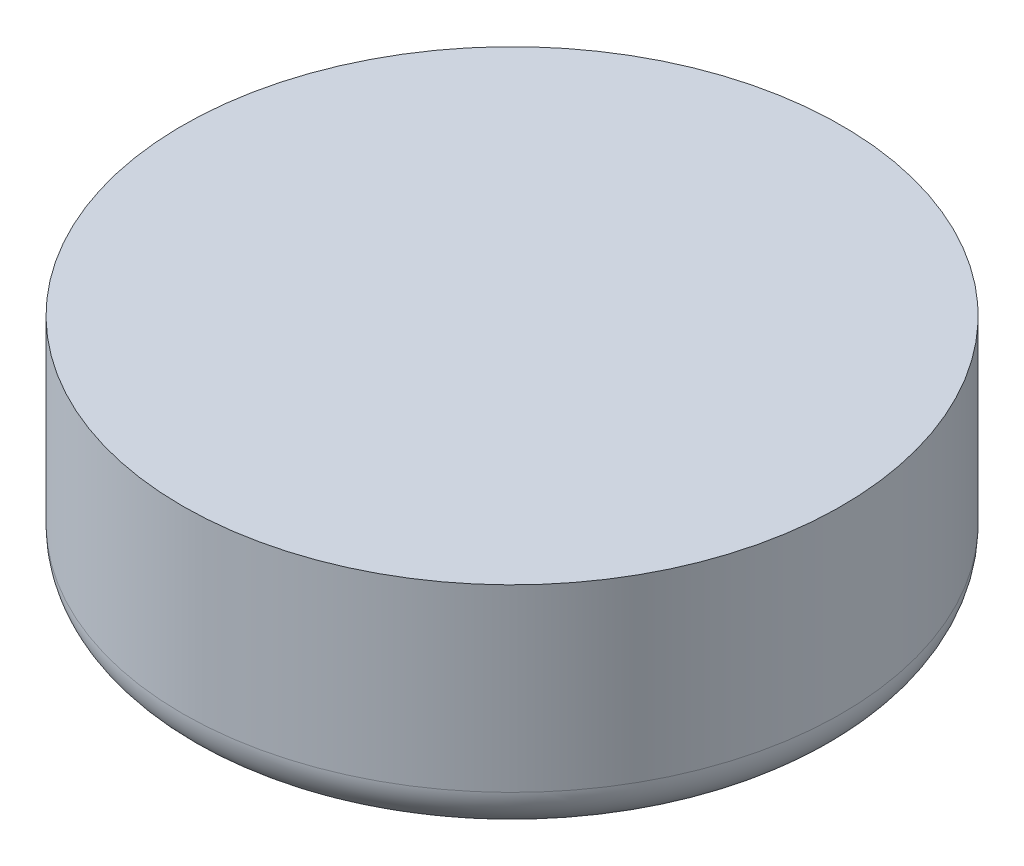
from build123d import *

# Parameters (mm, degrees)
SKETCH1_R           = 22
BOSS_EXTRUDE1_DEPTH = 15
FILLET1_R           = 3


with BuildPart() as part:
    # Sketch1 → Boss-Extrude1 (new body)
    with BuildSketch(Plane(origin=(0, 0, 0), x_dir=(1, 0, 0), z_dir=(0, 1, 0))):
        with Locations(Location((0, 0, 0), (0, 0, 270))):
            Circle(SKETCH1_R)
    extrude(amount=BOSS_EXTRUDE1_DEPTH)

    # Fillet1
    fillet1_edges = [part.edges().sort_by_distance(p)[0] for p in [
        (0, 0, -22),
    ]]
    fillet(fillet1_edges, radius=FILLET1_R)


solid = part.part
